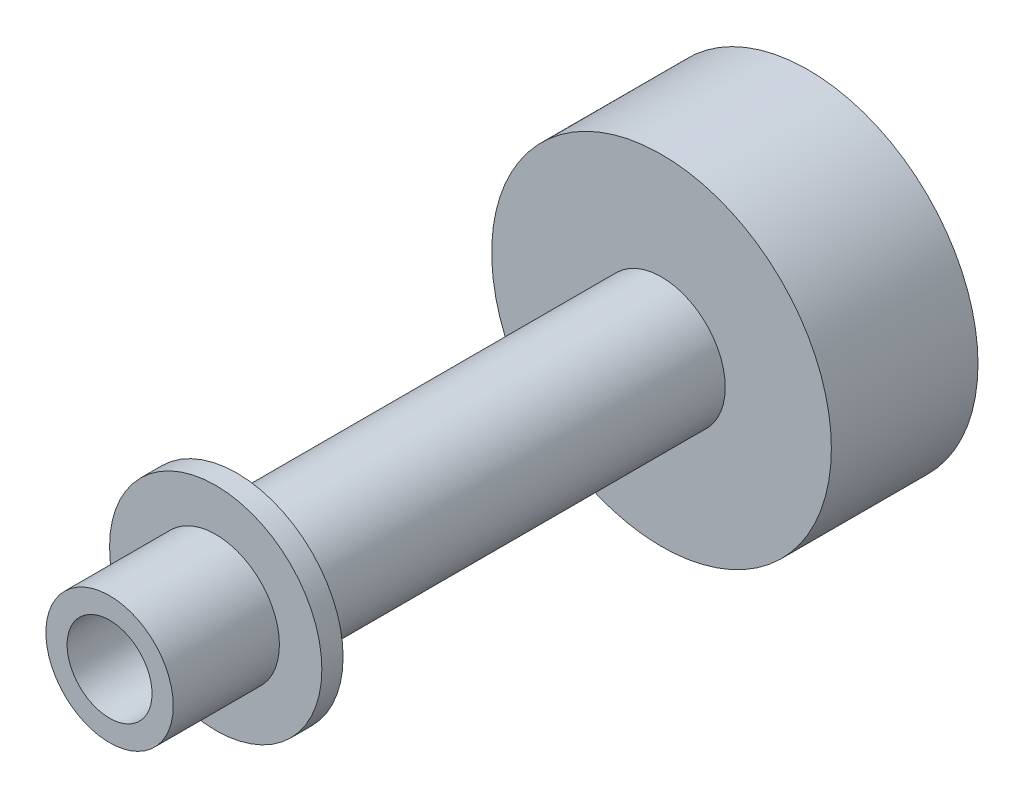
from build123d import *


with BuildPart() as part:
    # Sketch2 → Revolve1 (revolve)
    with BuildSketch(Plane(origin=(0, 0, 0), x_dir=(0, 0, -1), z_dir=(1, 0, 0)), mode=Mode.PRIVATE) as revolve1_sk:
        Polygon((0, 4), (0, 6), (10, 6), (10, 10), (12, 10), (12, 6), (52, 6), (52, 16), (65.814, 16), (65.814, 4), align=None)
    revolve(revolve1_sk.sketch.rotate(Axis((0, 0, 0), (0, 0, -1)), 90), axis=Axis((0, 0, 0), (0, 0, -1)))


solid = part.part
